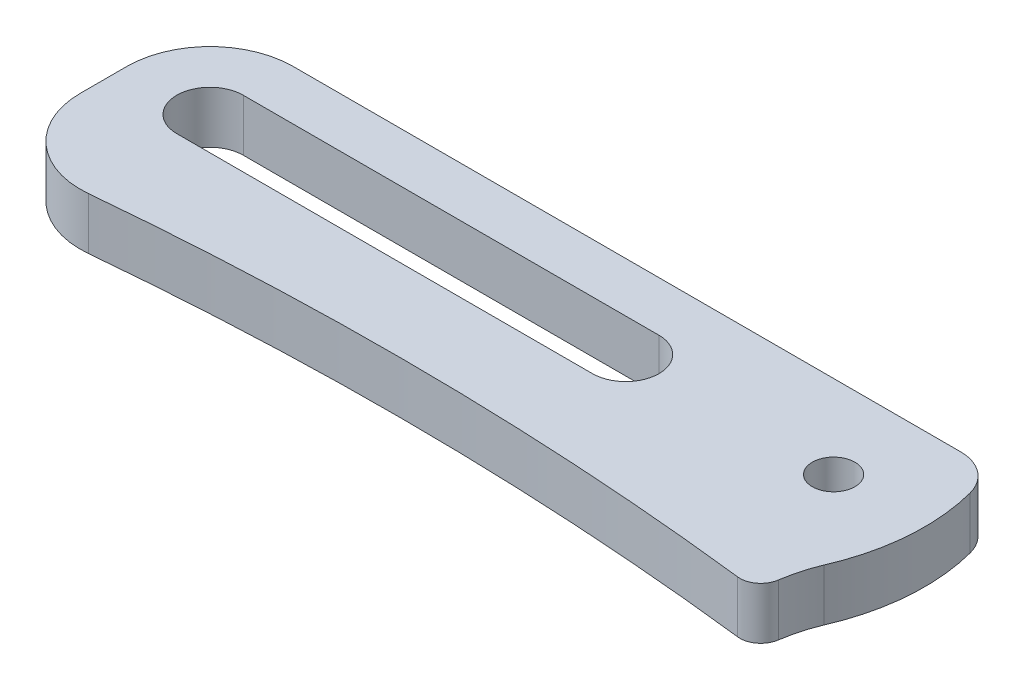
from build123d import *

# Parameters (mm, degrees)
SKETCH_1_R          = 1.025
EXTRUDE_1_DEPTH     = 2.5
EXTRUDE_3_DEPTH     = 2.5
EXTRUDE_2_DEPTH     = 2.5
FILLET_1_R          = 4
CUT_EXTRUDE_1_DEPTH = 2.5
FILLET_3_R          = 1
FILLET_4_R          = 2


with BuildPart() as part:
    # 草图1 → 凸台-拉伸1 (new body)
    with BuildSketch(Plane(origin=(0, 0, 0), x_dir=(1, 0, 0), z_dir=(0, 1, 0))):
        with BuildLine():
            Line((0, 4), (30, 4))
            ThreePointArc((30, 4), (34, 0), (30, -4))
            Line((30, -4), (0, -4))
            ThreePointArc((0, -4), (-4, 0), (0, 4))
        make_face()
        with Locations(Location((30, 0, 0), (0, 0, 270))):
            Circle(SKETCH_1_R, mode=Mode.SUBTRACT)
        with BuildLine():
            Line((0, 1.6), (20, 1.6))
            ThreePointArc((20, 1.6), (21.6, 0), (20, -1.6))
            Line((20, -1.6), (0, -1.6))
            ThreePointArc((0, -1.6), (-1.6, 0), (0, 1.6))
        make_face(mode=Mode.SUBTRACT)
    extrude(amount=EXTRUDE_1_DEPTH)

    # 草图4 → 凸台-拉伸3 (add)
    with BuildSketch(Plane(origin=(0, 0, 0), x_dir=(1, 0, 0), z_dir=(0, 1, 0))):
        with BuildLine():
            Line((35, 4), (30, 4))
            ThreePointArc((30, 4), (34, 0), (30, -4))
            Line((30, -4), (35, -4))
            Line((35, -4), (35, 4))
        make_face()
    extrude(amount=EXTRUDE_3_DEPTH)

    # 草图2 → 凸台-拉伸2 (add)
    with BuildSketch(Plane.XZ):
        with BuildLine():
            Line((-4, 6.7), (-4, 0))
            ThreePointArc((-4, 0), (-2.828427125, 2.828427125), (0, 4))
            Line((0, 4), (33.541672043, 4))
            ThreePointArc((33.541672043, 4), (33.13675384, 5.32310053), (33, 6.7))
            ThreePointArc((33, 6.7), (14.5, 5.554795019), (-4, 6.7))
        make_face()
    extrude(amount=-EXTRUDE_2_DEPTH)

    # 圆角1
    fillet_1_edges = [part.edges().sort_by_distance(p)[0] for p in [
        (-4, 1.25, 6.7),
    ]]
    fillet(fillet_1_edges, radius=FILLET_1_R)

    # 草图5 → 切除-拉伸1 (cut)
    with BuildSketch(Plane(origin=(0, 2.5, 0), x_dir=(1, 0, 0), z_dir=(0, 1, 0))):
        with BuildLine():
            ThreePointArc((34.376520653, 0), (34.165583782, -2.043096437), (33.541672043, -4))
            Line((33.541672043, -4), (35, -4))
            Line((35, -4), (35, 4))
            Line((35, 4), (33.541672043, 4))
            ThreePointArc((33.541672043, 4), (34.165583782, 2.043096437), (34.376520653, 0))
        make_face()
    extrude(amount=-CUT_EXTRUDE_1_DEPTH, mode=Mode.SUBTRACT)

    # 圆角3
    fillet_3_edges = [part.edges().sort_by_distance(p)[0] for p in [
        (33, 1.25, 6.7),
    ]]
    fillet(fillet_3_edges, radius=FILLET_3_R)

    # 圆角4
    fillet_4_edges = [part.edges().sort_by_distance(p)[0] for p in [
        (33.541672043, 1.25, -4),
    ]]
    fillet(fillet_4_edges, radius=FILLET_4_R)


solid = part.part
